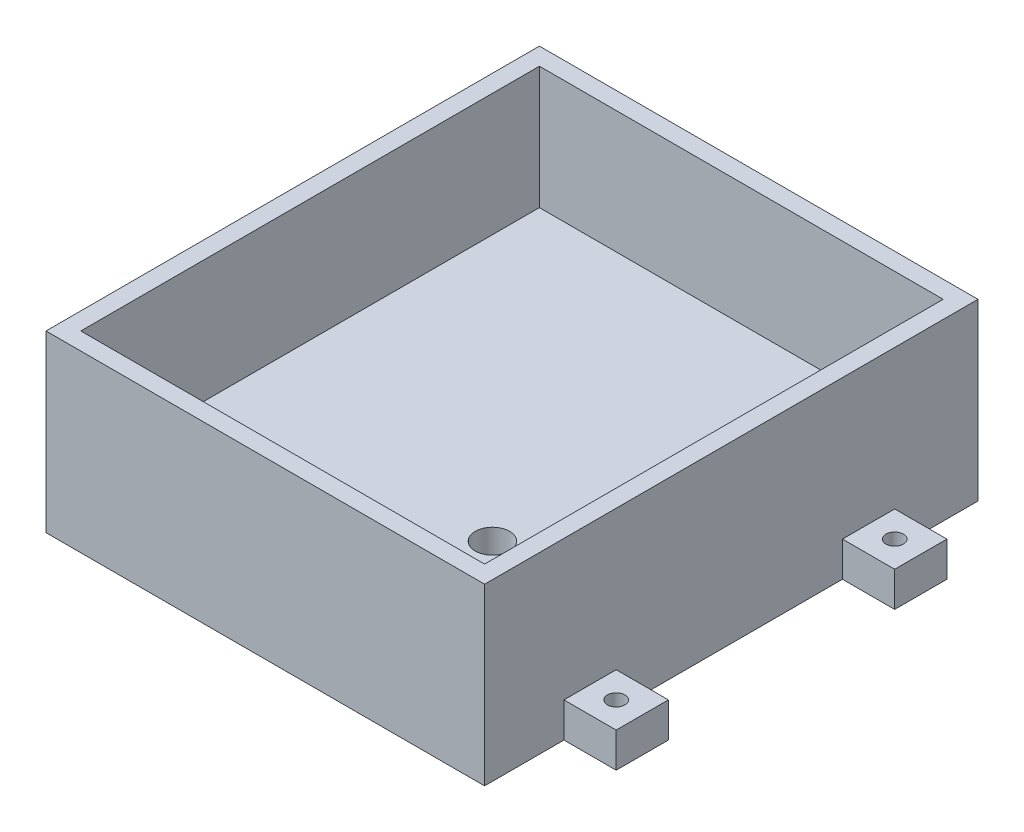
from build123d import *

# Parameters (mm, degrees)
SKETCH1_W           = 160
SKETCH1_H           = 180
BOSS_EXTRUDE1_DEPTH = 19.05
SKETCH2_W           = 160
SKETCH2_H           = 180
SKETCH2_W_2         = 147.3
SKETCH2_H_2         = 167.3
BOSS_EXTRUDE2_DEPTH = 44.680000048
SKETCH3_R           = 6.253999938
CUT_EXTRUDE1_DEPTH  = 12.7
SKETCH4_W           = 19.05
SKETCH4_H           = 19.05
SKETCH4_R           = 3.175
BOSS_EXTRUDE3_DEPTH = 12.7


with BuildPart() as part:
    # Sketch1 → Boss-Extrude1 (new body)
    with BuildSketch(Plane(origin=(0, 0, 0), x_dir=(1, 0, 0), z_dir=(0, 1, 0))):
        Rectangle(SKETCH1_W, SKETCH1_H)
    extrude(amount=BOSS_EXTRUDE1_DEPTH)

    # Sketch2 → Boss-Extrude2 (add)
    with BuildSketch(Plane(origin=(0, 19.05, 0), x_dir=(1, 0, 0), z_dir=(0, 1, 0))):
        Rectangle(SKETCH2_W, SKETCH2_H)
        Rectangle(SKETCH2_W_2, SKETCH2_H_2, mode=Mode.SUBTRACT)
    extrude(amount=BOSS_EXTRUDE2_DEPTH)

    # Sketch3 → Cut-Extrude1 (cut)
    with BuildSketch(Plane(origin=(0, 19.05, 0), x_dir=(1, 0, 0), z_dir=(0, 1, 0))):
        with Locations(Location((38.41, -45.55, 0), (0, 0, 270))):
            Circle(SKETCH3_R)
        with Locations(Location((23.17, -45.55, 0), (0, 0, 270))):
            Circle(SKETCH3_R)
        with Locations(Location((38.41, -30.31, 0), (0, 0, 270))):
            Circle(SKETCH3_R)
        with Locations(Location((23.17, -30.31, 0), (0, 0, 270))):
            Circle(SKETCH3_R)
    extrude(amount=-CUT_EXTRUDE1_DEPTH, mode=Mode.SUBTRACT)

    # Sketch4 → Boss-Extrude3 (add)
    # profile 1 of 4: a face of its own
    with BuildSketch(Plane.XZ):
        with Locations((-89.525, -50.08)):
            Rectangle(SKETCH4_W, SKETCH4_H)
        with Locations(Location((-89.525, -50.08, 0), (0, 0, 270))):
            Circle(SKETCH4_R, mode=Mode.SUBTRACT)
    # profile 2 of 4: a face of its own
    with BuildSketch(Plane.XZ):
        with Locations((-89.525, 51.52)):
            Rectangle(SKETCH4_W, SKETCH4_H)
        with Locations(Location((-89.525, 51.52, 0), (0, 0, 270))):
            Circle(SKETCH4_R, mode=Mode.SUBTRACT)
    # profile 3 of 4: a face of its own
    with BuildSketch(Plane.XZ):
        with Locations((89.525, -50.08)):
            Rectangle(SKETCH4_W, SKETCH4_H)
        with Locations(Location((89.525, -50.08, 0), (0, 0, 270))):
            Circle(SKETCH4_R, mode=Mode.SUBTRACT)
    # profile 4 of 4: a face of its own
    with BuildSketch(Plane.XZ):
        with Locations((89.525, 51.52)):
            Rectangle(SKETCH4_W, SKETCH4_H)
        with Locations(Location((89.525, 51.52, 0), (0, 0, 270))):
            Circle(SKETCH4_R, mode=Mode.SUBTRACT)
    extrude(amount=-BOSS_EXTRUDE3_DEPTH)


solid = part.part
